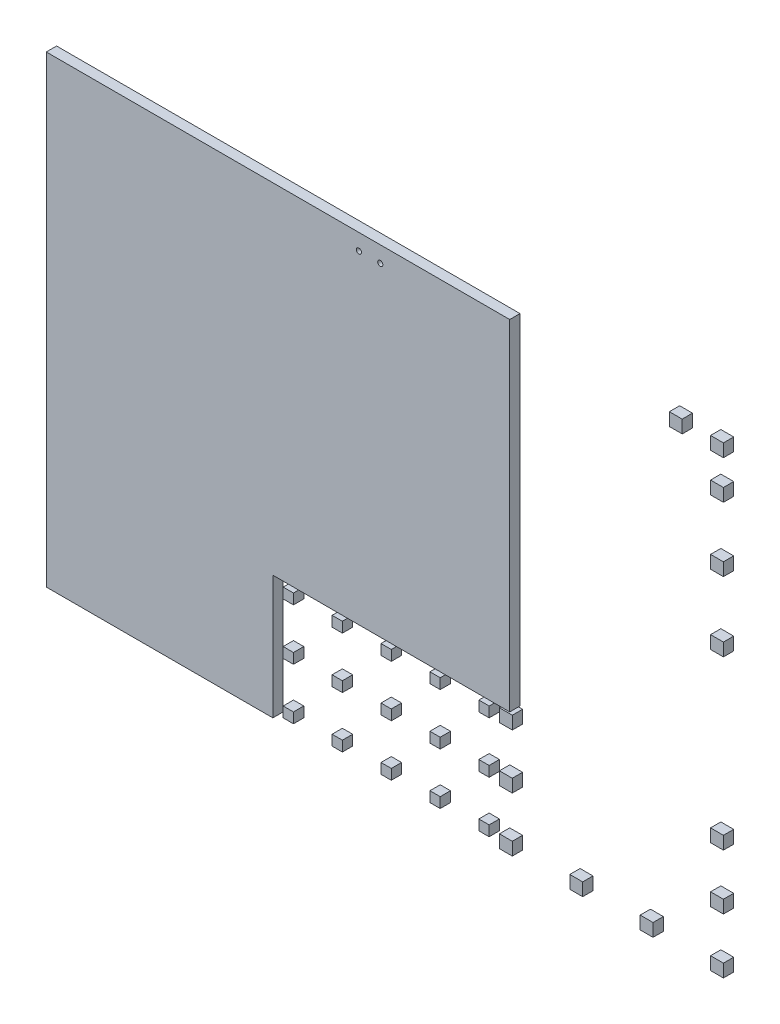
from build123d import *

# Parameters (mm, degrees)
SKETCH_1_R         = 50
EXTRUDE_1_DEPTH    = 200
SKETCH_1_W         = 250
SKETCH_1_H         = 250
EXTRUDE_1_2_DEPTH  = 200
EXTRUDE_1_3_DEPTH  = 200
EXTRUDE_1_4_DEPTH  = 200
EXTRUDE_1_5_DEPTH  = 200
EXTRUDE_1_6_DEPTH  = 200
EXTRUDE_1_7_DEPTH  = 200
EXTRUDE_1_8_DEPTH  = 200
EXTRUDE_1_9_DEPTH  = 200
EXTRUDE_1_10_DEPTH = 200
EXTRUDE_1_11_DEPTH = 200
EXTRUDE_1_12_DEPTH = 200
EXTRUDE_1_13_DEPTH = 200
EXTRUDE_1_14_DEPTH = 200
SKETCH_1_W_2       = 200
SKETCH_1_H_2       = 200
EXTRUDE_1_15_DEPTH = 200
EXTRUDE_1_16_DEPTH = 200
EXTRUDE_1_17_DEPTH = 200
EXTRUDE_1_18_DEPTH = 200
EXTRUDE_1_19_DEPTH = 200
EXTRUDE_1_20_DEPTH = 200
EXTRUDE_1_21_DEPTH = 200
EXTRUDE_1_22_DEPTH = 200
EXTRUDE_1_23_DEPTH = 200
EXTRUDE_1_24_DEPTH = 200
EXTRUDE_1_25_DEPTH = 200
EXTRUDE_1_26_DEPTH = 200
EXTRUDE_1_27_DEPTH = 200
EXTRUDE_1_28_DEPTH = 200
EXTRUDE_1_29_DEPTH = 200


with BuildPart() as part:
    # Эскиз1 → Бобышка-Вытянуть1 (new body)
    with BuildSketch(Plane.XY):
        Polygon((0, 0), (9000, 0), (9000, -6600), (4400, -6600), (4400, -9000), (0, -9000), align=None)
        with Locations((6486.244831881, -312.492160742)):
            Circle(SKETCH_1_R, mode=Mode.SUBTRACT)
        with Locations((6070.943926101, -312.492160742)):
            Circle(SKETCH_1_R, mode=Mode.SUBTRACT)
    extrude(amount=-EXTRUDE_1_DEPTH)


with BuildPart() as body_2:
    # Эскиз1 → Extrude 1 2 (new body)
    with BuildSketch(Plane.XY):
        with Locations((8925, -8875)):
            Rectangle(SKETCH_1_W, SKETCH_1_H)
    extrude(amount=-EXTRUDE_1_2_DEPTH)


with BuildPart() as body_3:
    # Эскиз1 → Extrude 1 3 (new body)
    with BuildSketch(Plane.XY):
        with Locations((8925, -6755)):
            Rectangle(SKETCH_1_W, SKETCH_1_H)
    extrude(amount=-EXTRUDE_1_3_DEPTH)


with BuildPart() as body_4:
    # Эскиз1 → Extrude 1 4 (new body)
    with BuildSketch(Plane.XY):
        with Locations((8925, -7815)):
            Rectangle(SKETCH_1_W, SKETCH_1_H)
    extrude(amount=-EXTRUDE_1_4_DEPTH)


with BuildPart() as body_5:
    # Эскиз1 → Extrude 1 5 (new body)
    with BuildSketch(Plane.XY):
        with Locations((10291.666666667, -8875)):
            Rectangle(SKETCH_1_W, SKETCH_1_H)
    extrude(amount=-EXTRUDE_1_5_DEPTH)


with BuildPart() as body_6:
    # Эскиз1 → Extrude 1 6 (new body)
    with BuildSketch(Plane.XY):
        with Locations((11658.333333333, -8875)):
            Rectangle(SKETCH_1_W, SKETCH_1_H)
    extrude(amount=-EXTRUDE_1_6_DEPTH)


with BuildPart() as body_7:
    # Эскиз1 → Extrude 1 7 (new body)
    with BuildSketch(Plane.XY):
        with Locations((13025, -8875)):
            Rectangle(SKETCH_1_W, SKETCH_1_H)
    extrude(amount=-EXTRUDE_1_7_DEPTH)


with BuildPart() as body_8:
    # Эскиз1 → Extrude 1 8 (new body)
    with BuildSketch(Plane.XY):
        with Locations((13025, -6725)):
            Rectangle(SKETCH_1_W, SKETCH_1_H)
    extrude(amount=-EXTRUDE_1_8_DEPTH)


with BuildPart() as body_9:
    # Эскиз1 → Extrude 1 9 (new body)
    with BuildSketch(Plane.XY):
        with Locations((13025, -7800)):
            Rectangle(SKETCH_1_W, SKETCH_1_H)
    extrude(amount=-EXTRUDE_1_9_DEPTH)


with BuildPart() as body_10:
    # Эскиз1 → Extrude 1 10 (new body)
    with BuildSketch(Plane.XY):
        with Locations((13025, -3475)):
            Rectangle(SKETCH_1_W, SKETCH_1_H)
    extrude(amount=-EXTRUDE_1_10_DEPTH)


with BuildPart() as body_11:
    # Эскиз1 → Extrude 1 11 (new body)
    with BuildSketch(Plane.XY):
        with Locations((13025, -2125)):
            Rectangle(SKETCH_1_W, SKETCH_1_H)
    extrude(amount=-EXTRUDE_1_11_DEPTH)


with BuildPart() as body_12:
    # Эскиз1 → Extrude 1 12 (new body)
    with BuildSketch(Plane.XY):
        with Locations((13025, -875)):
            Rectangle(SKETCH_1_W, SKETCH_1_H)
    extrude(amount=-EXTRUDE_1_12_DEPTH)


with BuildPart() as body_13:
    # Эскиз1 → Extrude 1 13 (new body)
    with BuildSketch(Plane.XY):
        with Locations((13025, -125)):
            Rectangle(SKETCH_1_W, SKETCH_1_H)
    extrude(amount=-EXTRUDE_1_13_DEPTH)


with BuildPart() as body_14:
    # Эскиз1 → Extrude 1 14 (new body)
    with BuildSketch(Plane.XY):
        with Locations((12225, -125)):
            Rectangle(SKETCH_1_W, SKETCH_1_H)
    extrude(amount=-EXTRUDE_1_14_DEPTH)


with BuildPart() as body_15:
    # Эскиз1 → Extrude 1 15 (new body)
    with BuildSketch(Plane.XY):
        with Locations((4700, -6800)):
            Rectangle(SKETCH_1_W_2, SKETCH_1_H_2)
    extrude(amount=-EXTRUDE_1_15_DEPTH)


with BuildPart() as body_16:
    # Эскиз1 → Extrude 1 16 (new body)
    with BuildSketch(Plane.XY):
        with Locations((4700, -7800)):
            Rectangle(SKETCH_1_W_2, SKETCH_1_H_2)
    extrude(amount=-EXTRUDE_1_16_DEPTH)


with BuildPart() as body_17:
    # Эскиз1 → Extrude 1 17 (new body)
    with BuildSketch(Plane.XY):
        with Locations((4700, -8800)):
            Rectangle(SKETCH_1_W_2, SKETCH_1_H_2)
    extrude(amount=-EXTRUDE_1_17_DEPTH)


with BuildPart() as body_18:
    # Эскиз1 → Extrude 1 18 (new body)
    with BuildSketch(Plane.XY):
        with Locations((5650, -6800)):
            Rectangle(SKETCH_1_W_2, SKETCH_1_H_2)
    extrude(amount=-EXTRUDE_1_18_DEPTH)


with BuildPart() as body_19:
    # Эскиз1 → Extrude 1 19 (new body)
    with BuildSketch(Plane.XY):
        with Locations((5650, -7800)):
            Rectangle(SKETCH_1_W_2, SKETCH_1_H_2)
    extrude(amount=-EXTRUDE_1_19_DEPTH)


with BuildPart() as body_20:
    # Эскиз1 → Extrude 1 20 (new body)
    with BuildSketch(Plane.XY):
        with Locations((5650, -8800)):
            Rectangle(SKETCH_1_W_2, SKETCH_1_H_2)
    extrude(amount=-EXTRUDE_1_20_DEPTH)


with BuildPart() as body_21:
    # Эскиз1 → Extrude 1 21 (new body)
    with BuildSketch(Plane.XY):
        with Locations((6600, -6800)):
            Rectangle(SKETCH_1_W_2, SKETCH_1_H_2)
    extrude(amount=-EXTRUDE_1_21_DEPTH)


with BuildPart() as body_22:
    # Эскиз1 → Extrude 1 22 (new body)
    with BuildSketch(Plane.XY):
        with Locations((6600, -7800)):
            Rectangle(SKETCH_1_W_2, SKETCH_1_H_2)
    extrude(amount=-EXTRUDE_1_22_DEPTH)


with BuildPart() as body_23:
    # Эскиз1 → Extrude 1 23 (new body)
    with BuildSketch(Plane.XY):
        with Locations((6600, -8800)):
            Rectangle(SKETCH_1_W_2, SKETCH_1_H_2)
    extrude(amount=-EXTRUDE_1_23_DEPTH)


with BuildPart() as body_24:
    # Эскиз1 → Extrude 1 24 (new body)
    with BuildSketch(Plane.XY):
        with Locations((7550, -6800)):
            Rectangle(SKETCH_1_W_2, SKETCH_1_H_2)
    extrude(amount=-EXTRUDE_1_24_DEPTH)


with BuildPart() as body_25:
    # Эскиз1 → Extrude 1 25 (new body)
    with BuildSketch(Plane.XY):
        with Locations((7550, -7800)):
            Rectangle(SKETCH_1_W_2, SKETCH_1_H_2)
    extrude(amount=-EXTRUDE_1_25_DEPTH)


with BuildPart() as body_26:
    # Эскиз1 → Extrude 1 26 (new body)
    with BuildSketch(Plane.XY):
        with Locations((7550, -8800)):
            Rectangle(SKETCH_1_W_2, SKETCH_1_H_2)
    extrude(amount=-EXTRUDE_1_26_DEPTH)


with BuildPart() as body_27:
    # Эскиз1 → Extrude 1 27 (new body)
    with BuildSketch(Plane.XY):
        with Locations((8500, -6800)):
            Rectangle(SKETCH_1_W_2, SKETCH_1_H_2)
    extrude(amount=-EXTRUDE_1_27_DEPTH)


with BuildPart() as body_28:
    # Эскиз1 → Extrude 1 28 (new body)
    with BuildSketch(Plane.XY):
        with Locations((8500, -7800)):
            Rectangle(SKETCH_1_W_2, SKETCH_1_H_2)
    extrude(amount=-EXTRUDE_1_28_DEPTH)


with BuildPart() as body_29:
    # Эскиз1 → Extrude 1 29 (new body)
    with BuildSketch(Plane.XY):
        with Locations((8500, -8800)):
            Rectangle(SKETCH_1_W_2, SKETCH_1_H_2)
    extrude(amount=-EXTRUDE_1_29_DEPTH)


solid = Compound([part.part, body_2.part, body_3.part, body_4.part, body_5.part, body_6.part, body_7.part, body_8.part, body_9.part, body_10.part, body_11.part, body_12.part, body_13.part, body_14.part, body_15.part, body_16.part, body_17.part, body_18.part, body_19.part, body_20.part, body_21.part, body_22.part, body_23.part, body_24.part, body_25.part, body_26.part, body_27.part, body_28.part, body_29.part])
